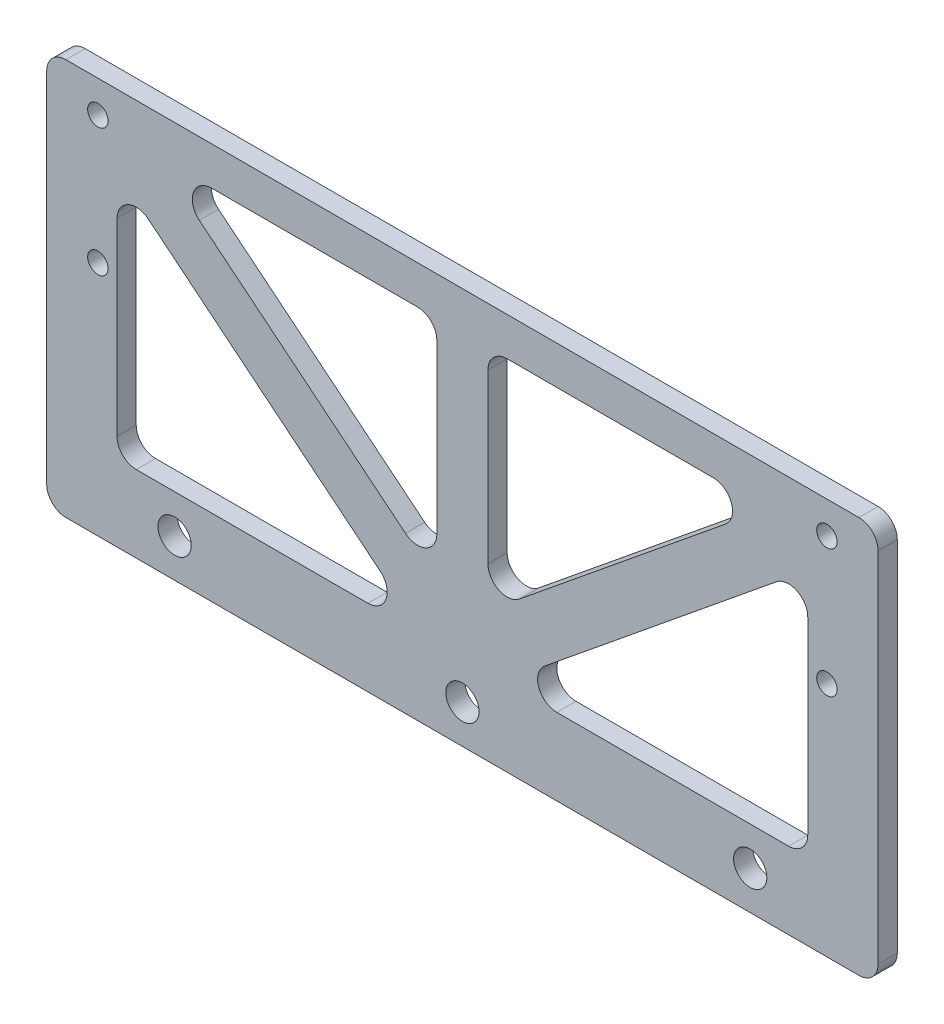
from build123d import *

# Parameters (mm, degrees)
SKETCH_1_W          = 130
SKETCH_1_H          = 62
EXTRUDE_1_DEPTH     = 3
SKETCH_2_R          = 2.6
CUT_EXTRUDE_1_DEPTH = 73.076348409
SKETCH_3_R          = 1.6
CUT_EXTRUDE_2_DEPTH = 73.076348409
CUT_EXTRUDE_3_DEPTH = 73.076348409
FILLET_1_R          = 3
FILLET_2_R          = 3


with BuildPart() as part:
    # 草图1 → 凸台-拉伸1 (new body)
    with BuildSketch(Plane.XY):
        Rectangle(SKETCH_1_W, SKETCH_1_H)
    extrude(amount=EXTRUDE_1_DEPTH)

    # 草图2 → 切除-拉伸1 (cut, through all)
    with BuildSketch(Plane.XY.offset(3)):
        with Locations((-45, -25)):
            Circle(SKETCH_2_R)
        with Locations((0, -25)):
            Circle(SKETCH_2_R)
        with Locations((45, -25)):
            Circle(SKETCH_2_R)
    extrude(amount=-CUT_EXTRUDE_1_DEPTH, mode=Mode.SUBTRACT)

    # 草图3 → 切除-拉伸2 (cut, through all)
    with BuildSketch(Plane.XY.offset(3)):
        with Locations((57, 26)):
            Circle(SKETCH_3_R)
        with Locations((57, 6)):
            Circle(SKETCH_3_R)
    cut_extrude_2 = extrude(amount=-CUT_EXTRUDE_2_DEPTH, mode=Mode.SUBTRACT)

    # 镜向1: 切除-拉伸2 across plane
    add(cut_extrude_2.mirror(Plane(origin=(0, 0, 0), x_dir=(0, 0, 1), z_dir=(1, 0, 0))), mode=Mode.SUBTRACT)

    # 草图4 → 切除-拉伸3 (cut, through all)
    with BuildSketch(Plane.XY.offset(3)):
        Polygon((-6.332390824, -19), (-54, 19.840274143), (-54, -19), align=None)
        Polygon((-4, 25), (-47.667609176, 25), (-4, -10.581014884), align=None)
        Polygon((4, 25), (4, -10.581014884), (47.667609176, 25), align=None)
        Polygon((54, 19.840274143), (6.332390824, -19), (54, -19), align=None)
    extrude(amount=-CUT_EXTRUDE_3_DEPTH, mode=Mode.SUBTRACT)

    # 圆角1
    fillet_1_edges = [part.edges().sort_by_distance(p)[0] for p in [
        (-47.667609176, 25, 1.5),
        (-4, 25, 1.5),
        (-4, -10.581014884, 1.5),
        (4, -10.581014884, 1.5),
        (4, 25, 1.5),
        (47.667609176, 25, 1.5),
        (6.332390824, -19, 1.5),
        (54, 19.840274143, 1.5),
        (54, -19, 1.5),
        (-54, 19.840274143, 1.5),
        (-6.332390824, -19, 1.5),
        (-54, -19, 1.5),
    ]]
    fillet(fillet_1_edges, radius=FILLET_1_R)

    # 圆角2
    fillet_2_edges = [part.edges().sort_by_distance(p)[0] for p in [
        (65, -31, 1.5),
        (-65, -31, 1.5),
        (-65, 31, 1.5),
        (65, 31, 1.5),
    ]]
    fillet(fillet_2_edges, radius=FILLET_2_R)


solid = part.part
